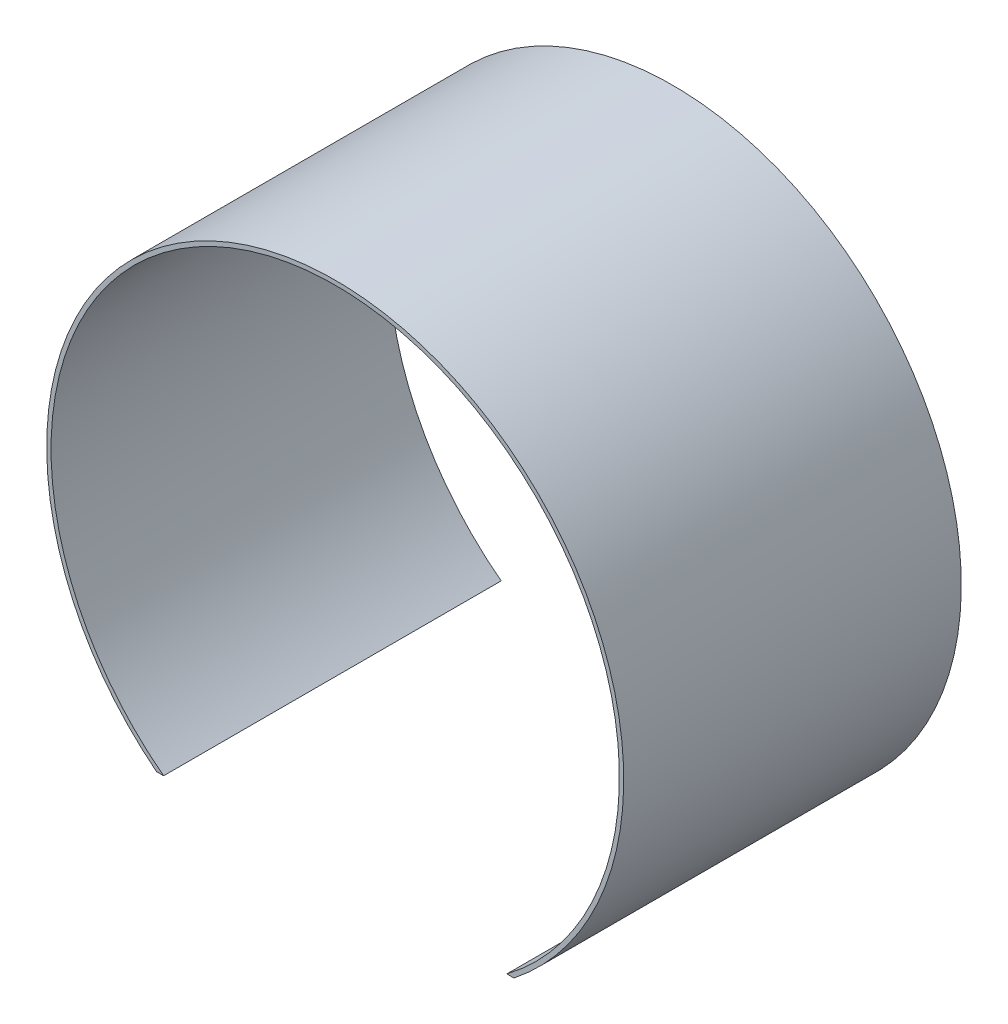
from build123d import *

# Parameters (mm, degrees)
EXTRUDE_1_DEPTH = 117


with BuildPart() as part:
    # 草图2 → 凸台-拉伸1 (new body)
    with BuildSketch(Plane.XY):
        with BuildLine():
            Line((-61.927630674, -78.517313754), (-59.475048894, -78.517313754))
            ThreePointArc((-59.475048894, -78.517313754), (0, 98.5), (59.475048894, -78.517313754))
            Line((59.475048894, -78.517313754), (61.927630674, -78.517313754))
            ThreePointArc((61.927630674, -78.517313754), (0, 100), (-61.927630674, -78.517313754))
        make_face()
    extrude(amount=EXTRUDE_1_DEPTH)


solid = part.part
